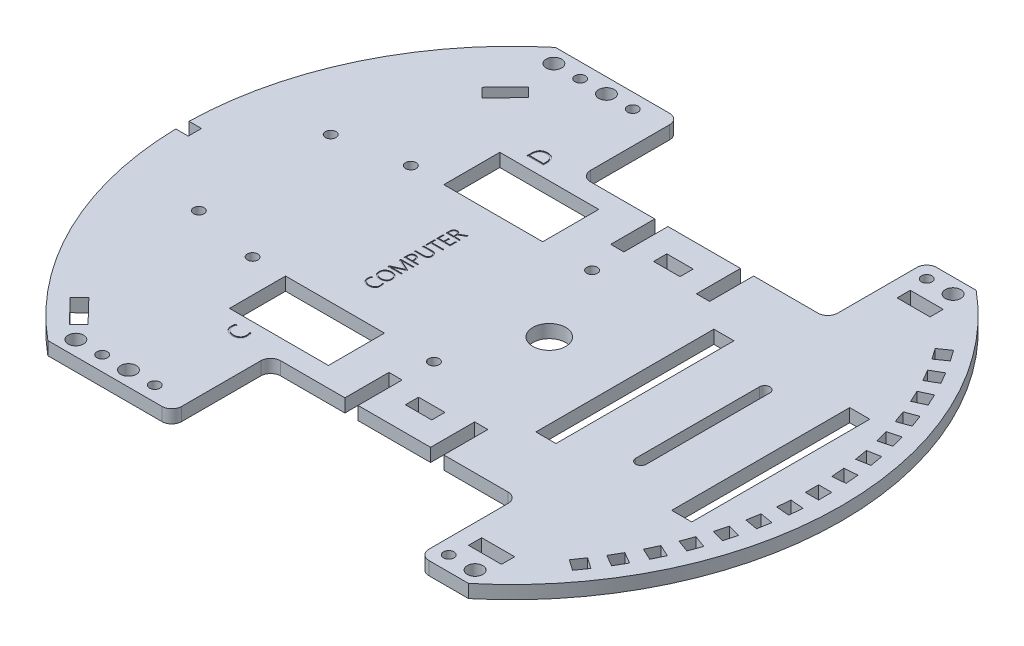
from build123d import *

# Parameters (mm, degrees)
BASIS_DEPTH         = 4
SKETCH2_W           = 4
SKETCH2_H           = 4
MODU_BRACKET_DEPTH  = 4
SKETCH3_W           = 75
SKETCH3_H           = 30
SKETCH3_W_2         = 8
SKETCH3_H_2         = 4
SKETCH3_R           = 5
CUT_EXTRUDE2_DEPTH  = 127.273512662
SKETCH4_W           = 6.1
SKETCH4_H           = 54
CUT_EXTRUDE3_DEPTH  = 4
SKETCH5_W           = 4
SKETCH5_H           = 14
CUT_EXTRUDE4_DEPTH  = 4
SKETCH6_W           = 10
SKETCH6_H           = 4
CUT_EXTRUDE5_DEPTH  = 4
SKETCH9_R           = 1.6
CUT_EXTRUDE7_DEPTH  = 4
SKETCH10_W          = 3.8
SKETCH10_H          = 4
SKETCH10_W_2        = 30
SKETCH10_H_2        = 17
CUT_EXTRUDE8_DEPTH  = 4
SKETCH11_R          = 1.6
CUT_EXTRUDE9_DEPTH  = 4
CUT_EXTRUDE15_DEPTH = 0.2
SKETCH21_R          = 2.35
SKETCH21_R_2        = 1.6
CUT_EXTRUDE16_DEPTH = 4
FILLET1_R           = 3


with BuildPart() as part:
    # Sketch1 → Basis (new body)
    with BuildSketch(Plane(origin=(0, 0, 0), x_dir=(1, 0, 0), z_dir=(0, 1, 0))):
        with BuildLine():
            Line((63.804388564, 77), (-63.804388564, 77))
            ThreePointArc((-63.804388564, 77), (-100, 0), (-63.804388564, -77))
            Line((-63.804388564, -77), (63.804388564, -77))
            ThreePointArc((63.804388564, -77), (90.499831095, -42.541515862), (100, 0))
            ThreePointArc((100, 0), (90.499831095, 42.541515862), (63.804388564, 77))
        make_face()
    extrude(amount=BASIS_DEPTH)

    # Sketch2 → Modu bracket (cut)
    with BuildSketch(Plane(origin=(0, 4, 0), x_dir=(1, 0, 0), z_dir=(0, 1, 0))):
        Polygon((90.817009036, -6.191182133), (94.801787829, -6.539805104), (94.453164858, -10.524583897), (90.468386065, -10.175960926), align=None)
        with Locations((93, 0)):
            Rectangle(SKETCH2_W, SKETCH2_H)
        Polygon((89.920805845, -14.335245632), (93.860036857, -15.029838343), (93.165444147, -18.969069355), (89.226213135, -18.274476644), align=None)
        Polygon((88.318211075, -22.370209256), (92.18191438, -23.405485436), (91.1466382, -27.269188741), (87.282934895, -26.233912561), align=None)
        Polygon((86.021421439, -30.23492208), (89.780191922, -31.603002653), (88.412111349, -35.361773136), (84.653340866, -33.993692563), align=None)
        Polygon((83.047916894, -37.86952889), (86.673148042, -39.560001937), (84.982674995, -43.185233085), (81.357443847, -41.494760038), align=None)
        Polygon((79.420327603, -45.21592572), (82.884429218, -47.21592572), (80.884429218, -50.680027335), (77.420327603, -48.680027335), align=None)
        Polygon((75.166261713, -52.218202052), (78.442869891, -54.512507797), (76.148564145, -57.789115975), (72.871955968, -55.494810229), align=None)
        Polygon((90.468386065, 10.175960926), (94.453164858, 10.524583897), (94.801787829, 6.539805104), (90.817009036, 6.191182133), align=None)
        Polygon((89.226213135, 18.274476644), (93.165444147, 18.969069355), (93.860036857, 15.029838343), (89.920805845, 14.335245632), align=None)
        Polygon((87.282934895, 26.233912561), (91.1466382, 27.269188741), (92.18191438, 23.405485436), (88.318211075, 22.370209256), align=None)
        Polygon((84.653340866, 33.993692563), (88.412111349, 35.361773136), (89.780191922, 31.603002653), (86.021421439, 30.23492208), align=None)
        Polygon((81.357443847, 41.494760038), (84.982674995, 43.185233085), (86.673148042, 39.560001937), (83.047916894, 37.86952889), align=None)
        Polygon((77.420327603, 48.680027335), (80.884429218, 50.680027335), (82.884429218, 47.21592572), (79.420327603, 45.21592572), align=None)
        Polygon((72.871955968, 55.494810229), (76.148564145, 57.789115975), (78.44286989, 54.512507797), (75.166261713, 52.218202052), align=None)
    extrude(amount=-MODU_BRACKET_DEPTH, mode=Mode.SUBTRACT)

    # Sketch3 → Cut-Extrude2 (cut, through all)
    with BuildSketch(Plane(origin=(0, 4, 0), x_dir=(1, 0, 0), z_dir=(0, 1, 0))):
        with Locations((11.304388564, -62)):
            Rectangle(SKETCH3_W, SKETCH3_H)
        with Locations((11.304388564, 62)):
            Rectangle(SKETCH3_W, SKETCH3_H)
        with Locations((11.304388564, -37.65)):
            Rectangle(SKETCH3_W_2, SKETCH3_H_2)
        with Locations((11.304388564, 37.65)):
            Rectangle(SKETCH3_W_2, SKETCH3_H_2)
        with Locations(Location((11.304388564, 0, 0), (0, 0, 270))):
            Circle(SKETCH3_R)
    extrude(amount=-CUT_EXTRUDE2_DEPTH, mode=Mode.SUBTRACT)

    # Sketch4 → Cut-Extrude3 (cut)
    with BuildSketch(Plane(origin=(0, 4, 0), x_dir=(1, 0, 0), z_dir=(0, 1, 0))):
        with BuildLine():
            Line((56.282145861, -18.75), (56.282145861, 18.75))
            ThreePointArc((56.282145861, 18.75), (57.882145861, 20.35), (59.482145861, 18.75))
            Line((59.482145861, 18.75), (59.482145861, -18.75))
            ThreePointArc((59.482145861, -18.75), (57.882145861, -20.35), (56.282145861, -18.75))
        make_face()
        with Locations((78.482145861, 0)):
            Rectangle(SKETCH4_W, SKETCH4_H)
        with Locations((37.282145861, 0)):
            Rectangle(SKETCH4_W, SKETCH4_H)
    extrude(amount=-CUT_EXTRUDE3_DEPTH, mode=Mode.SUBTRACT)

    # Sketch5 → Cut-Extrude4 (cut)
    with BuildSketch(Plane(origin=(0, 4, 0), x_dir=(1, 0, 0), z_dir=(0, 1, 0))):
        with Locations((-1.695611436, -40.64)):
            Rectangle(SKETCH5_W, SKETCH5_H)
        with Locations((-1.695611436, 40.64)):
            Rectangle(SKETCH5_W, SKETCH5_H)
        with Locations((24.304388564, 40.64)):
            Rectangle(SKETCH5_W, SKETCH5_H)
        with Locations((24.304388564, -40.64)):
            Rectangle(SKETCH5_W, SKETCH5_H)
    extrude(amount=-CUT_EXTRUDE4_DEPTH, mode=Mode.SUBTRACT)

    # Sketch6 → Cut-Extrude5 (cut)
    with BuildSketch(Plane(origin=(0, 4, 0), x_dir=(1, 0, 0), z_dir=(0, 1, 0))):
        Polygon((-61.633938747, 52.56838484), (-54.687355042, 59.761782843), (-57.564714243, 62.540416325), (-64.511297948, 55.347018321), align=None)
        Polygon((-61.891914367, -66.71914491), (-68.838498071, -59.525746907), (-71.715857273, -62.304380389), (-64.769273568, -69.497778392), align=None)
        with Locations((58.804388564, -65)):
            Rectangle(SKETCH6_W, SKETCH6_H)
        with Locations((58.804388564, 65)):
            Rectangle(SKETCH6_W, SKETCH6_H)
    extrude(amount=-CUT_EXTRUDE5_DEPTH, mode=Mode.SUBTRACT)

    # Sketch9 → Cut-Extrude7 (cut)
    with BuildSketch(Plane(origin=(0, 4, 0), x_dir=(1, 0, 0), z_dir=(0, 1, 0))):
        with Locations(Location((-54.695611436, -24, 0), (0, 0, 270))):
            Circle(SKETCH9_R)
        with Locations(Location((-54.695611436, 24, 0), (0, 0, 270))):
            Circle(SKETCH9_R)
        with Locations(Location((0.304388564, 24, 0), (0, 0, 270))):
            Circle(SKETCH9_R)
        with Locations(Location((0.304388564, -24, 0), (0, 0, 270))):
            Circle(SKETCH9_R)
    extrude(amount=-CUT_EXTRUDE7_DEPTH, mode=Mode.SUBTRACT)

    # Sketch10 → Cut-Extrude8 (cut)
    with BuildSketch(Plane(origin=(0, 4, 0), x_dir=(1, 0, 0), z_dir=(0, 1, 0))):
        with Locations((-98.1, 0)):
            Rectangle(SKETCH10_W, SKETCH10_H)
        with Locations((-29.695611436, 32.5)):
            Rectangle(SKETCH10_W_2, SKETCH10_H_2)
        with Locations((-29.695611436, -32.5)):
            Rectangle(SKETCH10_W_2, SKETCH10_H_2)
    extrude(amount=-CUT_EXTRUDE8_DEPTH, mode=Mode.SUBTRACT)

    # Sketch11 → Cut-Extrude9 (cut)
    with BuildSketch(Plane(origin=(0, 4, 0), x_dir=(1, 0, 0), z_dir=(0, 1, 0))):
        with Locations(Location((-75, -20, 0), (0, 0, 270))):
            Circle(SKETCH11_R)
        with Locations(Location((-75, 20, 0), (0, 0, 270))):
            Circle(SKETCH11_R)
    extrude(amount=-CUT_EXTRUDE9_DEPTH, mode=Mode.SUBTRACT)

    # Sketch19 → Cut-Extrude15 (cut)
    # profile 1 of 10: a face of its own
    with BuildSketch(Plane(origin=(0, 4, 0), x_dir=(1, 0, 0), z_dir=(0, 1, 0))):
        with BuildLine():
            Line((-27.620116509, 13.789473684), (-28.764030983, 13.189967105))
            add(Edge.make_bspline(
                [(-28.764030983, 13.189967105), (-28.791190547, 13.175211367), (-28.843592501, 13.146741487), (-28.919163135, 13.104737241), (-28.986003035, 13.060475386), (-29.065302202, 13.007064011), (-29.14879643, 12.937773157), (-29.231285032, 12.850032048), (-29.29100747, 12.755802777), (-29.331930074, 12.655323047), (-29.352858252, 12.545282642), (-29.355550789, 12.469106119), (-29.356958614, 12.429276316)],
                knots=[0, 0, 0, 0, 0.903061509, 1.742376591, 2.524256031, 3.243953603, 4.534835044, 5.685456425, 6.747387141, 7.774944003, 8.836602936, 10, 10, 10, 10], degree=3))
            Line((-29.356958614, 12.429276316), (-29.356958614, 11.990953947))
            Line((-29.356958614, 11.990953947), (-27.620116509, 11.990953947))
            Line((-27.620116509, 11.990953947), (-27.620116509, 11.621710526))
            Line((-27.620116509, 11.621710526), (-31.620116509, 11.621710526))
            Line((-31.620116509, 11.621710526), (-31.620116509, 12.768092105))
            add(Edge.make_bspline(
                [(-31.620116509, 12.768092105), (-31.619412802, 12.805142521), (-31.61800612, 12.879204758), (-31.603996193, 12.988790924), (-31.583783484, 13.096991137), (-31.554174196, 13.202303344), (-31.516727853, 13.304310481), (-31.470328532, 13.400701886), (-31.416868601, 13.491838282), (-31.354912712, 13.576650612), (-31.285461998, 13.655539408), (-31.205410049, 13.724282057), (-31.118704721, 13.786903261), (-31.023010732, 13.840130596), (-30.919277559, 13.884676653), (-30.806154605, 13.914164388), (-30.685789781, 13.934075928), (-30.602658625, 13.935796469), (-30.560083614, 13.936677632)],
                knots=[0, 0, 0, 0, 1.004805807, 2.00856497, 2.99321005, 3.989362039, 4.973079627, 5.937859508, 6.888195761, 7.835879596, 8.784030328, 9.732822668, 10.692572006, 11.681589819, 12.698300189, 13.746622881, 14.845949456, 16, 16, 16, 16], degree=3))
            add(Edge.make_bspline(
                [(-30.560083614, 13.936677632), (-30.52524678, 13.935808295), (-30.456751093, 13.934099017), (-30.356128023, 13.923003872), (-30.260059639, 13.901725085), (-30.167960111, 13.874289553), (-30.08053004, 13.8382729), (-29.99723593, 13.797206657), (-29.920325282, 13.746706883), (-29.847989459, 13.691207927), (-29.780916751, 13.628915963), (-29.718934824, 13.560651523), (-29.663248034, 13.485279984), (-29.611988695, 13.404691872), (-29.566789545, 13.317962075), (-29.527344121, 13.225925663), (-29.494177184, 13.128272064), (-29.47736302, 13.060716966), (-29.46880072, 13.026315789)],
                knots=[0, 0, 0, 0, 1.081046277, 2.125537793, 3.134839472, 4.130392803, 5.103344118, 6.065716514, 7.007073963, 7.952993041, 8.891926538, 9.84341236, 10.809648441, 11.796003091, 12.804193144, 13.840618968, 14.900375405, 16, 16, 16, 16], degree=3))
            Line((-29.46880072, 13.026315789), (-29.45810993, 13.026315789))
            add(Edge.make_bspline(
                [(-29.45810993, 13.026315789), (-29.445922114, 13.052193734), (-29.421698402, 13.103627058), (-29.372456595, 13.174713523), (-29.313138461, 13.240964793), (-29.242988271, 13.304555691), (-29.162417276, 13.3669573), (-29.069235382, 13.427894442), (-28.965005313, 13.491486215), (-28.889782191, 13.532152562), (-28.850379667, 13.553453947)],
                knots=[0, 0, 0, 0, 0.835845044, 1.66127139, 2.519262614, 3.433316564, 4.428101089, 5.498200815, 6.689535865, 8, 8, 8, 8], degree=3))
            Line((-28.850379667, 13.553453947), (-27.620116509, 14.222039474))
            Line((-27.620116509, 14.222039474), (-27.620116509, 13.789473684))
        make_face()
        with BuildLine():
            Line((-31.304327035, 11.990953947), (-29.672748088, 11.990953947))
            Line((-29.672748088, 11.990953947), (-29.672748088, 12.651315789))
            add(Edge.make_bspline(
                [(-29.672748088, 12.651315789), (-29.673695142, 12.683953649), (-29.675554534, 12.748032928), (-29.685509082, 12.84213515), (-29.706167779, 12.931545043), (-29.732150438, 13.01688928), (-29.764474449, 13.097810772), (-29.805546361, 13.171870215), (-29.8511839, 13.241087224), (-29.905382327, 13.302649763), (-29.964524058, 13.358576827), (-30.028974034, 13.408865386), (-30.100576985, 13.45038428), (-30.17681889, 13.4867416), (-30.258483814, 13.515992112), (-30.345845988, 13.535112857), (-30.437717221, 13.547970319), (-30.500827263, 13.549424438), (-30.532945456, 13.550164474)],
                knots=[0, 0, 0, 0, 1.118280553, 2.195567075, 3.234318192, 4.25595527, 5.249774383, 6.211909628, 7.151985671, 8.083820438, 9.01366643, 9.937615825, 10.876378126, 11.84235388, 12.828246894, 13.839520117, 14.900480674, 16, 16, 16, 16], degree=3))
            add(Edge.make_bspline(
                [(-30.532945456, 13.550164474), (-30.562317905, 13.54966745), (-30.619352905, 13.548702336), (-30.702391246, 13.537331564), (-30.780821481, 13.520674107), (-30.854250942, 13.495618246), (-30.923270113, 13.464591854), (-30.986768722, 13.425183376), (-31.046585396, 13.380355883), (-31.099916405, 13.326861544), (-31.148766241, 13.268224065), (-31.189717006, 13.202212387), (-31.225680587, 13.131179661), (-31.253980376, 13.053167718), (-31.27754426, 12.969188652), (-31.292198524, 12.878409844), (-31.302663751, 12.782041892), (-31.303762829, 12.71576591), (-31.304327035, 12.681743421)],
                knots=[0, 0, 0, 0, 1.067701683, 2.073247865, 3.043414083, 3.979944331, 4.890200411, 5.789743022, 6.693201142, 7.602801576, 8.531013581, 9.463287335, 10.422061572, 11.422253792, 12.476978517, 13.59009175, 14.762883996, 16, 16, 16, 16], degree=3))
            Line((-31.304327035, 12.681743421), (-31.304327035, 11.990953947))
        make_face(mode=Mode.SUBTRACT)
    # profile 2 of 10: a face of its own
    with BuildSketch(Plane(origin=(0, 4, 0), x_dir=(1, 0, 0), z_dir=(0, 1, 0))):
        Polygon((-27.620116509, 8.779605263), (-31.620116509, 8.779605263), (-31.620116509, 10.719572368), (-31.304327035, 10.719572368), (-31.304327035, 9.148848684), (-29.830642825, 9.148848684), (-29.830642825, 10.602796053), (-29.514853351, 10.602796053), (-29.514853351, 9.148848684), (-27.935905983, 9.148848684), (-27.935905983, 10.808388158), (-27.620116509, 10.808388158), align=None)
    # profile 3 of 10: a face of its own
    with BuildSketch(Plane(origin=(0, 4, 0), x_dir=(1, 0, 0), z_dir=(0, 1, 0))):
        Polygon((-31.304327035, 6.970394737), (-27.620116509, 6.970394737), (-27.620116509, 6.601151316), (-31.304327035, 6.601151316), (-31.304327035, 5.454769737), (-31.620116509, 5.454769737), (-31.620116509, 8.119243421), (-31.304327035, 8.119243421), align=None)
    # profile 4 of 10: a face of its own
    with BuildSketch(Plane(origin=(0, 4, 0), x_dir=(1, 0, 0), z_dir=(0, 1, 0))):
        with BuildLine():
            add(Edge.make_bspline(
                [(-29.236892825, 4.854440789), (-29.169420931, 4.853402494), (-29.038628789, 4.85138979), (-28.8490037, 4.834023572), (-28.672588988, 4.805378693), (-28.508606268, 4.766454599), (-28.357803796, 4.714955689), (-28.220231134, 4.651110597), (-28.095143059, 4.577171434), (-27.982746797, 4.491525667), (-27.885576229, 4.392048983), (-27.798894196, 4.283510022), (-27.727135741, 4.162025828), (-27.668862365, 4.029332005), (-27.622335106, 3.8856292), (-27.591297482, 3.729960106), (-27.570869525, 3.5633166), (-27.568635715, 3.448255807), (-27.56748493, 3.388980263)],
                knots=[0, 0, 0, 0, 1.272094822, 2.465915786, 3.586784003, 4.639895922, 5.640312585, 6.586187648, 7.494834008, 8.375709258, 9.241964425, 10.110606718, 10.989112876, 11.893928501, 12.838771959, 13.8312382, 14.882725103, 16, 16, 16, 16], degree=3))
            add(Edge.make_bspline(
                [(-27.56748493, 3.388980263), (-27.5687221, 3.33245504), (-27.57111973, 3.222909421), (-27.590317717, 3.064109202), (-27.621313036, 2.916217065), (-27.664373714, 2.778796458), (-27.721901342, 2.652696673), (-27.790839288, 2.536952894), (-27.87280915, 2.432061503), (-27.968774519, 2.339646786), (-28.075946263, 2.256783751), (-28.196591568, 2.185777814), (-28.329445125, 2.126186178), (-28.474390198, 2.076398601), (-28.632313936, 2.039157082), (-28.802494325, 2.012506912), (-28.985191317, 1.995782274), (-29.111033044, 1.993683053), (-29.176037562, 1.992598684)],
                knots=[0, 0, 0, 0, 1.111652278, 2.154376957, 3.141109948, 4.080749178, 4.980876659, 5.861260347, 6.725325793, 7.590937817, 8.475341693, 9.384405097, 10.337639061, 11.335215598, 12.394594385, 13.524896759, 14.721466261, 16, 16, 16, 16], degree=3))
            Line((-29.176037562, 1.992598684), (-31.620116509, 1.992598684))
            Line((-31.620116509, 1.992598684), (-31.620116509, 2.361842105))
            Line((-31.620116509, 2.361842105), (-29.195774404, 2.361842105))
            add(Edge.make_bspline(
                [(-29.195774404, 2.361842105), (-29.142568754, 2.362573228), (-29.039569146, 2.363988593), (-28.890153836, 2.376506741), (-28.751069933, 2.396649339), (-28.622290757, 2.425176486), (-28.503932589, 2.46220281), (-28.395699864, 2.507109372), (-28.297877493, 2.560970495), (-28.209702978, 2.622526529), (-28.132831264, 2.694118943), (-28.065147552, 2.773803127), (-28.008270816, 2.863196203), (-27.962217081, 2.961687282), (-27.926714215, 3.069127594), (-27.901821763, 3.185208036), (-27.885581807, 3.310398901), (-27.884061094, 3.396875885), (-27.883274404, 3.441611842)],
                knots=[0, 0, 0, 0, 1.309829472, 2.535669114, 3.68874031, 4.767830525, 5.779663952, 6.738609548, 7.64788441, 8.524300816, 9.379246836, 10.227022699, 11.092033486, 11.979708973, 12.897486227, 13.871889042, 14.899093424, 16, 16, 16, 16], degree=3))
            add(Edge.make_bspline(
                [(-27.883274404, 3.441611842), (-27.884136617, 3.48387762), (-27.885805163, 3.5656699), (-27.901081268, 3.684286145), (-27.925010708, 3.795075528), (-27.960936426, 3.897364111), (-28.004982507, 3.992369897), (-28.060762457, 4.078102945), (-28.125542444, 4.156553709), (-28.200552466, 4.226739416), (-28.286518587, 4.287607156), (-28.381246218, 4.341615308), (-28.486825434, 4.385387274), (-28.601536922, 4.423039563), (-28.726814828, 4.449905923), (-28.861321373, 4.470676047), (-29.005852319, 4.483022486), (-29.105564066, 4.484456083), (-29.157123088, 4.485197368)],
                knots=[0, 0, 0, 0, 1.076453379, 2.083141037, 3.042254347, 3.958949106, 4.840013232, 5.704108844, 6.557266996, 7.427018169, 8.312858942, 9.235521398, 10.19942948, 11.219906867, 12.307810762, 13.459622977, 14.686420011, 16, 16, 16, 16], degree=3))
            Line((-29.157123088, 4.485197368), (-31.620116509, 4.485197368))
            Line((-31.620116509, 4.485197368), (-31.620116509, 4.854440789))
            Line((-31.620116509, 4.854440789), (-29.236892825, 4.854440789))
        make_face()
    # profile 5 of 10: a face of its own
    with BuildSketch(Plane(origin=(0, 4, 0), x_dir=(1, 0, 0), z_dir=(0, 1, 0))):
        with BuildLine():
            Line((-29.199063877, -0.745888158), (-27.620116509, -0.745888158))
            Line((-27.620116509, -0.745888158), (-27.620116509, -1.115131579))
            Line((-27.620116509, -1.115131579), (-31.620116509, -1.115131579))
            Line((-31.620116509, -1.115131579), (-31.620116509, -0.087993421))
            add(Edge.make_bspline(
                [(-31.620116509, -0.087993421), (-31.619249864, -0.037238436), (-31.617564184, 0.061483199), (-31.602211081, 0.204902168), (-31.579035634, 0.339542926), (-31.54514859, 0.464967068), (-31.502539098, 0.58155004), (-31.450715695, 0.688710937), (-31.390399521, 0.786792155), (-31.321150725, 0.87508684), (-31.24338185, 0.95378411), (-31.157131037, 1.022733508), (-31.062332241, 1.081099261), (-30.959283945, 1.128993584), (-30.84853776, 1.166967499), (-30.73002458, 1.193921256), (-30.603808767, 1.20949635), (-30.51736414, 1.211805836), (-30.472912562, 1.212993421)],
                knots=[0, 0, 0, 0, 1.236019132, 2.404134908, 3.509688229, 4.560971219, 5.564512457, 6.529176288, 7.455738066, 8.364122578, 9.256560592, 10.145092731, 11.047592091, 11.961726316, 12.907790279, 13.894302119, 14.917207481, 16, 16, 16, 16], degree=3))
            add(Edge.make_bspline(
                [(-30.472912562, 1.212993421), (-30.427617592, 1.211997653), (-30.338570172, 1.210040028), (-30.2077284, 1.191278957), (-30.08223177, 1.161198752), (-29.962919221, 1.117973154), (-29.849543048, 1.064768514), (-29.744358205, 0.999667547), (-29.647094982, 0.924051426), (-29.558274495, 0.838162366), (-29.476877343, 0.742643341), (-29.406582971, 0.635765877), (-29.344283681, 0.51976628), (-29.291919207, 0.393942771), (-29.249689054, 0.258901919), (-29.220646476, 0.114756947), (-29.201898522, -0.037881179), (-29.200024799, -0.142759937), (-29.199063877, -0.196546053)],
                knots=[0, 0, 0, 0, 1.016771988, 1.998917831, 2.962065238, 3.910459402, 4.84404989, 5.770119108, 6.682684896, 7.60578183, 8.540711207, 9.495240556, 10.473073674, 11.494142412, 12.551539424, 13.645496299, 14.792514225, 16, 16, 16, 16], degree=3))
            Line((-29.199063877, -0.196546053), (-29.199063877, -0.745888158))
        make_face()
        with BuildLine():
            Line((-31.304327035, -0.745888158), (-29.514853351, -0.745888158))
            Line((-29.514853351, -0.745888158), (-29.514853351, -0.21875))
            add(Edge.make_bspline(
                [(-29.514853351, -0.21875), (-29.515786323, -0.177344287), (-29.517599845, -0.096859335), (-29.52749163, 0.020446297), (-29.547849006, 0.129646217), (-29.573419649, 0.231833529), (-29.608403875, 0.325424853), (-29.649087462, 0.41249154), (-29.700007194, 0.490340323), (-29.756501561, 0.561954406), (-29.821182758, 0.624232285), (-29.891240705, 0.679436728), (-29.968881322, 0.724460555), (-30.052015982, 0.762959185), (-30.142365467, 0.790956285), (-30.238193723, 0.812908064), (-30.340476404, 0.824990505), (-30.410657532, 0.826519596), (-30.446596772, 0.827302632)],
                knots=[0, 0, 0, 0, 1.245486358, 2.420992219, 3.535117186, 4.582850288, 5.584387862, 6.535673548, 7.466376358, 8.375320672, 9.273093409, 10.160243496, 11.050948542, 11.965854676, 12.909609425, 13.88960899, 14.919284271, 16, 16, 16, 16], degree=3))
            add(Edge.make_bspline(
                [(-30.446596772, 0.827302632), (-30.481171962, 0.82650802), (-30.548328549, 0.824964619), (-30.645708628, 0.813202697), (-30.736767348, 0.794788225), (-30.82106435, 0.767459309), (-30.898843592, 0.732819341), (-30.970398255, 0.691097492), (-31.033689979, 0.640089567), (-31.091794518, 0.582980756), (-31.141302912, 0.516700137), (-31.185622348, 0.443654546), (-31.222441303, 0.362403508), (-31.252810278, 0.273745888), (-31.275389433, 0.177217374), (-31.292901256, 0.073733918), (-31.302529229, -0.037920409), (-31.303714359, -0.114840117), (-31.304327035, -0.154605263)],
                knots=[0, 0, 0, 0, 1.110849669, 2.157641729, 3.147624309, 4.092032564, 4.999009, 5.87981024, 6.745189988, 7.604811272, 8.491058283, 9.396021736, 10.346001286, 11.351693919, 12.402924693, 13.528211502, 14.722160645, 16, 16, 16, 16], degree=3))
            Line((-31.304327035, -0.154605263), (-31.304327035, -0.745888158))
        make_face(mode=Mode.SUBTRACT)
    # profile 6 of 10: a face of its own
    with BuildSketch(Plane(origin=(0, 4, 0), x_dir=(1, 0, 0), z_dir=(0, 1, 0))):
        with BuildLine():
            Line((-27.620116509, -2.487664474), (-30.381629667, -2.487664474))
            add(Edge.make_bspline(
                [(-30.381629667, -2.487664474), (-30.400544836, -2.487430305), (-30.441395185, -2.486924581), (-30.506639106, -2.485223564), (-30.580101736, -2.482665693), (-30.661543465, -2.479610475), (-30.750881399, -2.474362902), (-30.848469177, -2.468619009), (-30.954010253, -2.462086048), (-31.027190579, -2.457262863), (-31.065017825, -2.454769737)],
                knots=[0, 0, 0, 0, 0.663469798, 1.432869696, 2.289045709, 3.241657293, 4.291223725, 5.427728572, 6.670381085, 8, 8, 8, 8], degree=3))
            Line((-31.065017825, -2.454769737), (-31.065017825, -2.465460526))
            add(Edge.make_bspline(
                [(-31.065017825, -2.465460526), (-31.025776089, -2.477948058), (-30.952912142, -2.501134873), (-30.852309258, -2.53509602), (-30.767924741, -2.56427535), (-30.718682034, -2.586326987), (-30.696596772, -2.596217105)],
                knots=[0, 0, 0, 0, 1.263216973, 2.345537769, 3.257976802, 4, 4, 4, 4], degree=3))
            Line((-30.696596772, -2.596217105), (-27.620116509, -3.983552632))
            Line((-27.620116509, -3.983552632), (-27.620116509, -4.142269737))
            Line((-27.620116509, -4.142269737), (-30.677682298, -5.532894737))
            add(Edge.make_bspline(
                [(-30.677682298, -5.532894737), (-30.703079312, -5.543291408), (-30.758246421, -5.565874942), (-30.8494963, -5.596521383), (-30.955192105, -5.627708413), (-31.030691088, -5.647426283), (-31.070774404, -5.657894737)],
                knots=[0, 0, 0, 0, 0.797442207, 1.732195089, 2.795995166, 4, 4, 4, 4], degree=3))
            Line((-31.070774404, -5.657894737), (-31.070774404, -5.668585526))
            add(Edge.make_bspline(
                [(-31.070774404, -5.668585526), (-31.025011953, -5.665264152), (-30.927535017, -5.658189414), (-30.771999315, -5.653557679), (-30.598216443, -5.648710252), (-30.476206877, -5.648800981), (-30.412057298, -5.648848684)],
                knots=[0, 0, 0, 0, 0.835188276, 1.77900421, 2.832255964, 4, 4, 4, 4], degree=3))
            Line((-30.412057298, -5.648848684), (-27.620116509, -5.648848684))
            Line((-27.620116509, -5.648848684), (-27.620116509, -6.009868421))
            Line((-27.620116509, -6.009868421), (-31.620116509, -6.009868421))
            Line((-31.620116509, -6.009868421), (-31.620116509, -5.574013158))
            Line((-31.620116509, -5.574013158), (-28.613537562, -4.222861842))
            add(Edge.make_bspline(
                [(-28.613537562, -4.222861842), (-28.581524834, -4.208739712), (-28.517233222, -4.180378038), (-28.418585763, -4.139948293), (-28.316418785, -4.10008824), (-28.24527823, -4.078475981), (-28.208932298, -4.067434211)],
                knots=[0, 0, 0, 0, 0.967910463, 1.943868249, 2.949515866, 4, 4, 4, 4], degree=3))
            Line((-28.208932298, -4.067434211), (-28.208932298, -4.050164474))
            add(Edge.make_bspline(
                [(-28.208932298, -4.050164474), (-28.244522758, -4.037696078), (-28.312347461, -4.013935068), (-28.412999472, -3.981062246), (-28.511357802, -3.943789375), (-28.576381626, -3.91532077), (-28.610248088, -3.900493421)],
                knots=[0, 0, 0, 0, 1.05602382, 2.012463505, 2.964828222, 4, 4, 4, 4], degree=3))
            Line((-28.610248088, -3.900493421), (-31.620116509, -2.537828947))
            Line((-31.620116509, -2.537828947), (-31.620116509, -2.124177632))
            Line((-31.620116509, -2.124177632), (-27.620116509, -2.124177632))
            Line((-27.620116509, -2.124177632), (-27.620116509, -2.487664474))
        make_face()
    # profile 7 of 10: a face of its own
    with BuildSketch(Plane(origin=(0, 4, 0), x_dir=(1, 0, 0), z_dir=(0, 1, 0))):
        with BuildLine():
            add(Edge.make_bspline(
                [(-27.56748493, -8.704769737), (-27.569391499, -8.774765058), (-27.573124245, -8.911804256), (-27.602059682, -9.112158924), (-27.651685546, -9.301481244), (-27.71989135, -9.479652608), (-27.805960439, -9.645002095), (-27.905880183, -9.798472538), (-28.020613045, -9.938798401), (-28.149633495, -10.065794373), (-28.29121236, -10.179845704), (-28.446245737, -10.278383132), (-28.612223119, -10.364608025), (-28.789771158, -10.43551106), (-28.976198244, -10.492432526), (-29.170527852, -10.532611082), (-29.371690985, -10.556878902), (-29.508206919, -10.560064235), (-29.577353351, -10.561677632)],
                knots=[0, 0, 0, 0, 1.094690685, 2.143222323, 3.158357395, 4.150628525, 5.121089247, 6.069014929, 7.010663822, 7.950661171, 8.896275617, 9.849067524, 10.819528245, 11.81808022, 12.835468004, 13.864858446, 14.918533406, 16, 16, 16, 16], degree=3))
            add(Edge.make_bspline(
                [(-29.577353351, -10.561677632), (-29.653349927, -10.560102533), (-29.8021647, -10.557018211), (-30.020540101, -10.53268601), (-30.229177695, -10.49284664), (-30.427159702, -10.435963654), (-30.613839901, -10.365153129), (-30.786387979, -10.277143526), (-30.946184337, -10.176044406), (-31.09179119, -10.05963199), (-31.222264974, -9.928065171), (-31.337916386, -9.782794408), (-31.437889503, -9.623469765), (-31.522850616, -9.451238168), (-31.590926615, -9.265374461), (-31.637681695, -9.066284242), (-31.667352958, -8.855057129), (-31.670918518, -8.71008122), (-31.672748088, -8.635690789)],
                knots=[0, 0, 0, 0, 1.135098782, 2.222724729, 3.278053572, 4.304641296, 5.296355567, 6.256031204, 7.193259783, 8.116780063, 9.034726822, 9.955692206, 10.885077429, 11.839258921, 12.819953991, 13.83506688, 14.889123666, 16, 16, 16, 16], degree=3))
            add(Edge.make_bspline(
                [(-31.672748088, -8.635690789), (-31.67124688, -8.567047757), (-31.668308481, -8.432688938), (-31.638408186, -8.237090879), (-31.591893154, -8.051930803), (-31.525926338, -7.87790644), (-31.442277248, -7.715926195), (-31.345320997, -7.565103225), (-31.23246003, -7.427717568), (-31.105447371, -7.303308659), (-30.964908698, -7.192091828), (-30.812573203, -7.093791971), (-30.647211282, -7.010508542), (-30.470796051, -6.940796723), (-30.28379346, -6.886138459), (-30.088700577, -6.845307413), (-29.885189434, -6.822476929), (-29.747089552, -6.819134153), (-29.67685993, -6.817434211)],
                knots=[0, 0, 0, 0, 1.085622768, 2.124949721, 3.123492609, 4.102458151, 5.062878371, 6.003878161, 6.93486425, 7.870538747, 8.812308255, 9.766594808, 10.734744107, 11.73772532, 12.764517951, 13.814438789, 14.88854983, 16, 16, 16, 16], degree=3))
            add(Edge.make_bspline(
                [(-29.67685993, -6.817434211), (-29.602772503, -6.818634133), (-29.457211611, -6.820991642), (-29.243160491, -6.846186405), (-29.03728826, -6.883959814), (-28.840374042, -6.938479092), (-28.65392569, -7.00708156), (-28.478889044, -7.090251653), (-28.317448849, -7.189064503), (-28.169350201, -7.302523076), (-28.034577321, -7.429119226), (-27.915435239, -7.570746299), (-27.812250991, -7.726611023), (-27.73925172, -7.866718376), (-27.688699546, -7.985058754), (-27.657183534, -8.078545929), (-27.628706107, -8.174339801), (-27.60687946, -8.274221774), (-27.58846151, -8.377008132), (-27.576523151, -8.48360186), (-27.568835742, -8.593086926), (-27.567939322, -8.667201387), (-27.56748493, -8.704769737)],
                knots=[0, 0, 0, 0, 1.39256119, 2.735989868, 4.047258665, 5.325361257, 6.573039493, 7.778881373, 8.963537039, 10.125477781, 11.281399994, 12.433776708, 13.597534063, 14.789546312, 15.399401698, 16.015607094, 16.643664706, 17.277701547, 17.937028807, 18.606474621, 19.293627067, 20, 20, 20, 20], degree=3))
        make_face()
        with BuildLine():
            add(Edge.make_bspline(
                [(-31.356958614, -8.674342105), (-31.355143898, -8.732816249), (-31.351598761, -8.847048325), (-31.326201452, -9.013385769), (-31.282161915, -9.16916344), (-31.222118814, -9.314735807), (-31.146010157, -9.4488428), (-31.057130067, -9.572058472), (-30.95764267, -9.685571411), (-30.84506499, -9.787029068), (-30.720886817, -9.876733382), (-30.586930864, -9.955757965), (-30.442538013, -10.022747843), (-30.288763101, -10.077358824), (-30.127581477, -10.120618048), (-29.960445192, -10.151971034), (-29.788317234, -10.171088609), (-29.671699337, -10.174341542), (-29.612715193, -10.175986842)],
                knots=[0, 0, 0, 0, 1.086986669, 2.123481199, 3.118956744, 4.090024357, 5.043928893, 5.978815167, 6.910361557, 7.844900483, 8.789886759, 9.753974943, 10.732131513, 11.744488731, 12.784185878, 13.831722769, 14.903307476, 16, 16, 16, 16], degree=3))
            add(Edge.make_bspline(
                [(-29.612715193, -10.175986842), (-29.556491029, -10.175066484), (-29.444917714, -10.17324009), (-29.279319033, -10.157780292), (-29.117666488, -10.129109891), (-28.960013065, -10.091440285), (-28.808723271, -10.040341357), (-28.665590066, -9.977994658), (-28.531116248, -9.904572672), (-28.40673307, -9.818979681), (-28.292764964, -9.721573857), (-28.189728847, -9.612829459), (-28.10107298, -9.490502832), (-28.022810085, -9.357950393), (-27.959962532, -9.212319258), (-27.914816762, -9.054607159), (-27.88830887, -8.884940294), (-27.884985812, -8.768187865), (-27.883274404, -8.708059211)],
                knots=[0, 0, 0, 0, 1.057301632, 2.098148519, 3.123689704, 4.142744375, 5.143734472, 6.122601695, 7.075507161, 8.020739524, 8.95680323, 9.890478868, 10.830862553, 11.79198838, 12.780312955, 13.80499856, 14.869552578, 16, 16, 16, 16], degree=3))
            add(Edge.make_bspline(
                [(-27.883274404, -8.708059211), (-27.88470807, -8.647652107), (-27.887490488, -8.530415705), (-27.913188039, -8.360482028), (-27.952401035, -8.201363677), (-28.010797478, -8.054436056), (-28.082914641, -7.918933161), (-28.166357189, -7.794100988), (-28.264043768, -7.681900566), (-28.373726667, -7.581420324), (-28.495289608, -7.492507203), (-28.627550834, -7.414525108), (-28.771502244, -7.349880637), (-28.925443597, -7.296652344), (-29.088598956, -7.254897919), (-29.25955776, -7.224683031), (-29.438233351, -7.206068761), (-29.559763529, -7.204119434), (-29.621761246, -7.203125)],
                knots=[0, 0, 0, 0, 1.115134252, 2.16422109, 3.167586413, 4.136091443, 5.076129482, 5.998824188, 6.903404032, 7.8172756, 8.740914609, 9.680557075, 10.648174838, 11.650632594, 12.685942574, 13.755697576, 14.855085787, 16, 16, 16, 16], degree=3))
            add(Edge.make_bspline(
                [(-29.621761246, -7.203125), (-29.679920195, -7.203891193), (-29.794835079, -7.205405096), (-29.964781771, -7.222941672), (-30.130241965, -7.24873211), (-30.290408158, -7.28537938), (-30.443296115, -7.333474932), (-30.587052244, -7.3936427), (-30.721252017, -7.465276249), (-30.844760229, -7.549315458), (-30.957970378, -7.644918559), (-31.057455298, -7.754581883), (-31.146388244, -7.875416783), (-31.222402527, -8.008861932), (-31.282882135, -8.156033992), (-31.326380167, -8.316441529), (-31.35181394, -8.490967506), (-31.355202724, -8.611755901), (-31.356958614, -8.674342105)],
                knots=[0, 0, 0, 0, 1.084120281, 2.142087468, 3.182484255, 4.205468637, 5.202936944, 6.167483597, 7.10744408, 8.034683938, 8.948411588, 9.863753536, 10.7890328, 11.741351995, 12.720057716, 13.7480744, 14.833170384, 16, 16, 16, 16], degree=3))
        make_face(mode=Mode.SUBTRACT)
    # profile 8 of 10: a face of its own
    with BuildSketch(Plane(origin=(0, 4, 0), x_dir=(1, 0, 0), z_dir=(0, 1, 0))):
        with BuildLine():
            add(Edge.make_bspline(
                [(-27.783767825, -11.176809211), (-27.76618498, -11.215494683), (-27.730762995, -11.293429522), (-27.688133196, -11.415348176), (-27.650597759, -11.540931297), (-27.620516233, -11.670624823), (-27.596603274, -11.804288767), (-27.57917578, -11.942047536), (-27.569400813, -12.084010924), (-27.568127952, -12.180084265), (-27.56748493, -12.228618421)],
                knots=[0, 0, 0, 0, 0.941704103, 1.897134834, 2.860573505, 3.846822653, 4.847054991, 5.870017597, 6.923979344, 8, 8, 8, 8], degree=3))
            add(Edge.make_bspline(
                [(-27.56748493, -12.228618421), (-27.569038371, -12.297531549), (-27.572078324, -12.432388709), (-27.601385213, -12.629804555), (-27.646464646, -12.817829133), (-27.711991158, -12.995117561), (-27.793709955, -13.160615701), (-27.889310143, -13.314763856), (-27.999970307, -13.455864471), (-28.124819311, -13.58412833), (-28.263322833, -13.698277649), (-28.41424119, -13.799444458), (-28.577637028, -13.886646555), (-28.752725462, -13.95967529), (-28.93826613, -14.017398819), (-29.132677407, -14.058017314), (-29.335446882, -14.08353078), (-29.473383754, -14.086487524), (-29.543636246, -14.087993421)],
                knots=[0, 0, 0, 0, 1.08501409, 2.123280781, 3.13719125, 4.126390959, 5.094012464, 6.04068709, 6.978901718, 7.913421573, 8.85508874, 9.801329844, 10.77124231, 11.76817965, 12.785808208, 13.82762552, 14.893590094, 16, 16, 16, 16], degree=3))
            add(Edge.make_bspline(
                [(-29.543636246, -14.087993421), (-29.617730313, -14.08625829), (-29.763653005, -14.082841078), (-29.978520941, -14.055699424), (-30.185495356, -14.012406561), (-30.384143644, -13.951707241), (-30.572068523, -13.873696996), (-30.74832138, -13.780385245), (-30.911875106, -13.672426067), (-31.062306691, -13.549499923), (-31.198167342, -13.411915542), (-31.31922517, -13.260505057), (-31.42385821, -13.094711533), (-31.513647877, -12.916324989), (-31.586263643, -12.724859792), (-31.63478534, -12.520788768), (-31.668040694, -12.306184226), (-31.67115477, -12.159124644), (-31.672748088, -12.083881579)],
                knots=[0, 0, 0, 0, 1.08378236, 2.134427858, 3.16330646, 4.174419904, 5.168761633, 6.135810083, 7.087998613, 8.031361748, 8.972924254, 9.911843585, 10.862036619, 11.835980097, 12.829731186, 13.850132463, 14.900019834, 16, 16, 16, 16], degree=3))
            add(Edge.make_bspline(
                [(-31.672748088, -12.083881579), (-31.670897229, -12.001550067), (-31.667282377, -11.840751159), (-31.63780903, -11.606292038), (-31.590884835, -11.384633195), (-31.542077068, -11.245189362), (-31.518142825, -11.176809211)],
                knots=[0, 0, 0, 0, 1.06765162, 2.0851945, 3.06102201, 4, 4, 4, 4], degree=3))
            Line((-31.518142825, -11.176809211), (-31.12505072, -11.176809211))
            add(Edge.make_bspline(
                [(-31.12505072, -11.176809211), (-31.143641976, -11.212482124), (-31.180572647, -11.283344718), (-31.22688425, -11.393325323), (-31.268105931, -11.504352152), (-31.299451025, -11.618201294), (-31.325509063, -11.733367871), (-31.34304242, -11.850477842), (-31.355577105, -11.969300416), (-31.356495618, -12.049308421), (-31.356958614, -12.089638158)],
                knots=[0, 0, 0, 0, 1.014056328, 2.014376018, 3.007214784, 3.998584336, 4.989857471, 5.983225584, 6.983401938, 8, 8, 8, 8], degree=3))
            add(Edge.make_bspline(
                [(-31.356958614, -12.089638158), (-31.35554338, -12.152233237), (-31.3527811, -12.274407508), (-31.326484414, -12.452129231), (-31.28491744, -12.619316652), (-31.226403282, -12.775507863), (-31.152151694, -12.919798504), (-31.063992082, -13.052107185), (-30.964637401, -13.174336132), (-30.850016422, -13.282550903), (-30.725128985, -13.380226142), (-30.58772004, -13.464142291), (-30.440822993, -13.537594991), (-30.282907181, -13.597588542), (-30.116013416, -13.644129814), (-29.940814732, -13.677660755), (-29.758248418, -13.698871201), (-29.633881428, -13.701147552), (-29.570774404, -13.702302632)],
                knots=[0, 0, 0, 0, 1.107570837, 2.161777918, 3.172866549, 4.15268833, 5.107714033, 6.039155523, 6.963158462, 7.889935617, 8.823801425, 9.765215496, 10.735374581, 11.727712143, 12.750991723, 13.798913268, 14.883111716, 16, 16, 16, 16], degree=3))
            add(Edge.make_bspline(
                [(-29.570774404, -13.702302632), (-29.513692808, -13.701402748), (-29.400849584, -13.699623791), (-29.234731739, -13.679282876), (-29.073282832, -13.650727482), (-28.918080473, -13.607420052), (-28.769499251, -13.553833815), (-28.62951585, -13.488059638), (-28.500264742, -13.4093193), (-28.379871175, -13.320549276), (-28.271104014, -13.218852955), (-28.173380435, -13.105794927), (-28.08850461, -12.980461384), (-28.014911004, -12.844477085), (-27.95492315, -12.696740349), (-27.913734191, -12.536618281), (-27.887387574, -12.365457523), (-27.884670531, -12.24736062), (-27.883274404, -12.186677632)],
                knots=[0, 0, 0, 0, 1.072677432, 2.120550009, 3.142600351, 4.15293896, 5.145932548, 6.109654905, 7.055472448, 7.987354245, 8.917295511, 9.849234321, 10.791337022, 11.757605836, 12.752043041, 13.780945426, 14.859759584, 16, 16, 16, 16], degree=3))
            add(Edge.make_bspline(
                [(-27.883274404, -12.186677632), (-27.884017508, -12.139496775), (-27.885484713, -12.046341603), (-27.898509837, -11.909102763), (-27.917472681, -11.77593387), (-27.946984245, -11.64761779), (-27.982523518, -11.522758335), (-28.028310953, -11.40302658), (-28.080512882, -11.286907751), (-28.122265443, -11.213510014), (-28.143142825, -11.176809211)],
                knots=[0, 0, 0, 0, 1.072450921, 2.117476394, 3.132004095, 4.128451721, 5.108706732, 6.081083926, 7.040491356, 8, 8, 8, 8], degree=3))
            Line((-28.143142825, -11.176809211), (-27.783767825, -11.176809211))
        make_face()
    # profile 9 of 10: a face of its own
    with BuildSketch(Plane(origin=(0, 4, 0), x_dir=(1, 0, 0), z_dir=(0, 1, 0))):
        with BuildLine():
            Line((-34.695611436, 44.211348684), (-39.695611436, 44.211348684))
            Line((-39.695611436, 44.211348684), (-39.695611436, 45.518914474))
            add(Edge.make_bspline(
                [(-39.695611436, 45.518914474), (-39.694028016, 45.622124784), (-39.690954496, 45.822462535), (-39.661764298, 46.113189207), (-39.614232473, 46.384594504), (-39.546458385, 46.636471679), (-39.460163293, 46.86898819), (-39.355552588, 47.082872544), (-39.229170512, 47.275935731), (-39.08455638, 47.450444329), (-38.92016785, 47.603988067), (-38.737634354, 47.738155888), (-38.535925941, 47.850106556), (-38.316113537, 47.941628567), (-38.078662671, 48.014081651), (-37.822229823, 48.063005852), (-37.547972865, 48.094798521), (-37.358808964, 48.098313402), (-37.26140091, 48.100123355)],
                knots=[0, 0, 0, 0, 1.219485978, 2.367099538, 3.44902777, 4.472649525, 5.445245922, 6.376134433, 7.280329046, 8.165932322, 9.048363345, 9.932047934, 10.836723055, 11.767831754, 12.741430902, 13.765156789, 14.849189898, 16, 16, 16, 16], degree=3))
            add(Edge.make_bspline(
                [(-37.26140091, 48.100123355), (-37.167075162, 48.097995168), (-36.981904986, 48.093817339), (-36.710898489, 48.05973204), (-36.453389719, 48.001591681), (-36.209290545, 47.923106141), (-35.980319263, 47.821964994), (-35.767392152, 47.700941181), (-35.573018259, 47.557520975), (-35.395166391, 47.395613637), (-35.23569714, 47.214200992), (-35.094541819, 47.014279103), (-34.974601908, 46.795272239), (-34.873521667, 46.558839555), (-34.793590841, 46.305822001), (-34.735848748, 46.036427453), (-34.701864672, 45.751425086), (-34.697725489, 45.556013643), (-34.695611436, 45.456208882)],
                knots=[0, 0, 0, 0, 1.088117128, 2.136074667, 3.14511766, 4.130340795, 5.089761744, 6.028363337, 6.950398193, 7.871118262, 8.798334626, 9.731801164, 10.689142592, 11.673945198, 12.694256998, 13.745773381, 14.848672595, 16, 16, 16, 16], degree=3))
            Line((-34.695611436, 45.456208882), (-34.695611436, 44.211348684))
        make_face()
        with BuildLine():
            Line((-39.300874594, 44.672902961), (-35.090348278, 44.672902961))
            Line((-35.090348278, 44.672902961), (-35.090348278, 45.435649671))
            add(Edge.make_bspline(
                [(-35.090348278, 45.435649671), (-35.092264721, 45.51896896), (-35.096004515, 45.681560275), (-35.121049529, 45.919105243), (-35.166835477, 46.142403539), (-35.227758287, 46.352413504), (-35.307486009, 46.546932998), (-35.401581379, 46.727993393), (-35.515780934, 46.891595265), (-35.644837138, 47.041004206), (-35.790233697, 47.174081113), (-35.95236912, 47.290428092), (-36.13112557, 47.388776403), (-36.325290758, 47.471295509), (-36.53501234, 47.536127023), (-36.760194069, 47.581787244), (-37.000267616, 47.609973318), (-37.16537801, 47.613246548), (-37.250093344, 47.614925987)],
                knots=[0, 0, 0, 0, 1.146087312, 2.236503031, 3.280075387, 4.277767161, 5.239647988, 6.167318118, 7.078571647, 7.977306687, 8.878029249, 9.783155626, 10.715662226, 11.678627877, 12.6804192, 13.729553805, 14.835072687, 16, 16, 16, 16], degree=3))
            add(Edge.make_bspline(
                [(-37.250093344, 47.614925987), (-37.333072324, 47.613412785), (-37.493937254, 47.610479259), (-37.727195394, 47.586051633), (-37.943984094, 47.543522557), (-38.145656207, 47.487091443), (-38.33089935, 47.411384917), (-38.500616913, 47.320004545), (-38.654029659, 47.21139378), (-38.791208965, 47.085742043), (-38.911680903, 46.943173838), (-39.016458736, 46.784058473), (-39.104958946, 46.608463737), (-39.176514853, 46.41587341), (-39.233126583, 46.207410348), (-39.272584547, 45.982396502), (-39.296287369, 45.740778976), (-39.299312341, 45.574137828), (-39.300874594, 45.488075658)],
                knots=[0, 0, 0, 0, 1.174949677, 2.27778406, 3.316051809, 4.300538128, 5.23859307, 6.144038748, 7.024592755, 7.893517868, 8.771447346, 9.661060064, 10.585537062, 11.549906156, 12.565798079, 13.640440787, 14.781400693, 16, 16, 16, 16], degree=3))
            Line((-39.300874594, 45.488075658), (-39.300874594, 44.672902961))
        make_face(mode=Mode.SUBTRACT)
    # profile 10 of 10: a face of its own
    with BuildSketch(Plane(origin=(0, 4, 0), x_dir=(1, 0, 0), z_dir=(0, 1, 0))):
        with BuildLine():
            add(Edge.make_bspline(
                [(-34.900175581, -44.214432566), (-34.878197024, -44.262789407), (-34.833919544, -44.360207956), (-34.780632295, -44.512606272), (-34.733712998, -44.669585174), (-34.696111091, -44.831702081), (-34.666219892, -44.998782011), (-34.644435525, -45.170980473), (-34.632216816, -45.348434708), (-34.63062574, -45.468526383), (-34.629821963, -45.529194079)],
                knots=[0, 0, 0, 0, 0.941704103, 1.897134834, 2.860573505, 3.846822653, 4.847054991, 5.870017597, 6.923979344, 8, 8, 8, 8], degree=3))
            add(Edge.make_bspline(
                [(-34.629821963, -45.529194079), (-34.631763764, -45.615335488), (-34.635563705, -45.783906939), (-34.672197317, -46.030676747), (-34.728546607, -46.265707469), (-34.810454747, -46.487318004), (-34.912603244, -46.694190678), (-35.032103479, -46.886875873), (-35.170428683, -47.063251641), (-35.326489939, -47.223581465), (-35.499619342, -47.366268114), (-35.688267288, -47.492726625), (-35.892512085, -47.601729246), (-36.111372627, -47.693015165), (-36.343298463, -47.765169576), (-36.586312559, -47.815942695), (-36.839774403, -47.847834527), (-37.012195492, -47.851530458), (-37.100011107, -47.853412829)],
                knots=[0, 0, 0, 0, 1.08501409, 2.123280781, 3.13719125, 4.126390959, 5.094012464, 6.04068709, 6.978901718, 7.913421573, 8.85508874, 9.801329844, 10.77124231, 11.76817965, 12.785808208, 13.82762552, 14.893590094, 16, 16, 16, 16], degree=3))
            add(Edge.make_bspline(
                [(-37.100011107, -47.853412829), (-37.192628691, -47.851243915), (-37.375032057, -47.846972401), (-37.643616976, -47.813045333), (-37.902334995, -47.758929254), (-38.150645355, -47.683055104), (-38.385551453, -47.585542298), (-38.605867524, -47.468902609), (-38.810309682, -47.333953637), (-38.998349164, -47.180295956), (-39.168174978, -47.00831548), (-39.319497263, -46.819052374), (-39.450288562, -46.611810469), (-39.562525646, -46.388827289), (-39.653295354, -46.149495793), (-39.713947475, -45.894407013), (-39.755516668, -45.626151335), (-39.759409263, -45.442326858), (-39.76140091, -45.348273026)],
                knots=[0, 0, 0, 0, 1.08378236, 2.134427858, 3.16330646, 4.174419904, 5.168761633, 6.135810083, 7.087998613, 8.031361748, 8.972924254, 9.911843585, 10.862036619, 11.835980097, 12.829731186, 13.850132463, 14.900019834, 16, 16, 16, 16], degree=3))
            add(Edge.make_bspline(
                [(-39.76140091, -45.348273026), (-39.759087336, -45.245358637), (-39.754568772, -45.044360002), (-39.717727088, -44.7512861), (-39.659071844, -44.474212546), (-39.598062134, -44.299907755), (-39.568144331, -44.214432566)],
                knots=[0, 0, 0, 0, 1.06765162, 2.0851945, 3.06102201, 4, 4, 4, 4], degree=3))
            Line((-39.568144331, -44.214432566), (-39.076779199, -44.214432566))
            add(Edge.make_bspline(
                [(-39.076779199, -44.214432566), (-39.10001827, -44.259023708), (-39.146181609, -44.34760195), (-39.204071112, -44.485077707), (-39.255598213, -44.623861242), (-39.294779581, -44.766172671), (-39.327352129, -44.910130892), (-39.349268824, -45.056518355), (-39.364937181, -45.205046573), (-39.366085323, -45.305056579), (-39.366664068, -45.35546875)],
                knots=[0, 0, 0, 0, 1.014056328, 2.014376018, 3.007214784, 3.998584336, 4.989857471, 5.983225584, 6.983401938, 8, 8, 8, 8], degree=3))
            add(Edge.make_bspline(
                [(-39.366664068, -45.35546875), (-39.364895025, -45.433712599), (-39.361442175, -45.586430438), (-39.328571317, -45.808582591), (-39.2766126, -46.017566867), (-39.203469903, -46.212805881), (-39.110655417, -46.393169182), (-39.000455902, -46.558555034), (-38.876262552, -46.711341218), (-38.732986327, -46.846609682), (-38.576877031, -46.96870373), (-38.40511585, -47.073598917), (-38.221494541, -47.165414792), (-38.024099776, -47.24040673), (-37.81548257, -47.298583321), (-37.596484215, -47.340496997), (-37.368276322, -47.367010053), (-37.212817585, -47.369855493), (-37.133933805, -47.371299342)],
                knots=[0, 0, 0, 0, 1.107570837, 2.161777918, 3.172866549, 4.15268833, 5.107714033, 6.039155523, 6.963158462, 7.889935617, 8.823801425, 9.765215496, 10.735374581, 11.727712143, 12.750991723, 13.798913268, 14.883111716, 16, 16, 16, 16], degree=3))
            add(Edge.make_bspline(
                [(-37.133933805, -47.371299342), (-37.062581809, -47.370174488), (-36.92152778, -47.367950792), (-36.713880473, -47.342524647), (-36.512069341, -47.306830406), (-36.318066391, -47.252696118), (-36.132339863, -47.185713321), (-35.957360613, -47.1034956), (-35.795796727, -47.005070178), (-35.645304769, -46.894107647), (-35.509345818, -46.766987247), (-35.387191343, -46.625664711), (-35.281096562, -46.468997783), (-35.189104555, -46.299017409), (-35.114119737, -46.114346489), (-35.062633539, -45.914193904), (-35.029700267, -45.700242956), (-35.026303963, -45.552621827), (-35.024558805, -45.476768092)],
                knots=[0, 0, 0, 0, 1.072677432, 2.120550009, 3.142600351, 4.15293896, 5.145932548, 6.109654905, 7.055472448, 7.987354245, 8.917295511, 9.849234321, 10.791337022, 11.757605836, 12.752043041, 13.780945426, 14.859759584, 16, 16, 16, 16], degree=3))
            add(Edge.make_bspline(
                [(-35.024558805, -45.476768092), (-35.025487685, -45.417792021), (-35.027321692, -45.301348057), (-35.043603097, -45.129799506), (-35.067306652, -44.96333839), (-35.104196106, -44.802943291), (-35.148620197, -44.646868972), (-35.205854491, -44.497204278), (-35.271106903, -44.352055741), (-35.323297604, -44.260308571), (-35.349394331, -44.214432566)],
                knots=[0, 0, 0, 0, 1.072450921, 2.117476394, 3.132004095, 4.128451721, 5.108706732, 6.081083926, 7.040491356, 8, 8, 8, 8], degree=3))
            Line((-35.349394331, -44.214432566), (-34.900175581, -44.214432566))
        make_face()
    extrude(amount=-CUT_EXTRUDE15_DEPTH, mode=Mode.SUBTRACT)

    # Sketch21 → Cut-Extrude16 (cut)
    with BuildSketch(Plane(origin=(0, 4, 0), x_dir=(1, 0, 0), z_dir=(0, 1, 0))):
        with Locations(Location((-59.804388564, -72.5, 0), (0, 0, 270))):
            Circle(SKETCH21_R)
        with Locations(Location((-43.844388564, -72.5, 0), (0, 0, 270))):
            Circle(SKETCH21_R)
        with Locations(Location((61.284388564, -72.5, 0), (0, 0, 270))):
            Circle(SKETCH21_R)
        with Locations(Location((61.284388564, 72.5, 0), (0, 0, 270))):
            Circle(SKETCH21_R)
        with Locations(Location((-43.844388564, 72.5, 0), (0, 0, 270))):
            Circle(SKETCH21_R)
        with Locations(Location((-59.804388564, 72.5, 0), (0, 0, 270))):
            Circle(SKETCH21_R)
        with Locations(Location((-51.824388564, -72.5, 0), (0, 0, 270))):
            Circle(SKETCH21_R_2)
        with Locations(Location((-35.864388564, -72.5, 0), (0, 0, 270))):
            Circle(SKETCH21_R_2)
        with Locations(Location((53.304388564, -72.5, 0), (0, 0, 270))):
            Circle(SKETCH21_R_2)
        with Locations(Location((53.304388564, 72.5, 0), (0, 0, 270))):
            Circle(SKETCH21_R_2)
        with Locations(Location((-35.864388564, 72.5, 0), (0, 0, 270))):
            Circle(SKETCH21_R_2)
        with Locations(Location((-51.824388564, 72.5, 0), (0, 0, 270))):
            Circle(SKETCH21_R_2)
    extrude(amount=-CUT_EXTRUDE16_DEPTH, mode=Mode.SUBTRACT)

    # Fillet1
    fillet1_edges = [part.edges().sort_by_distance(p)[0] for p in [
        (48.804388564, 2, 77),
        (-26.195611436, 2, 77),
        (-26.195611436, 2, 47),
        (48.804388564, 2, 47),
        (48.804388564, 2, -77),
        (48.804388564, 2, -47),
        (-26.195611436, 2, -47),
        (-26.195611436, 2, -77),
    ]]
    fillet(fillet1_edges, radius=FILLET1_R)


solid = part.part
